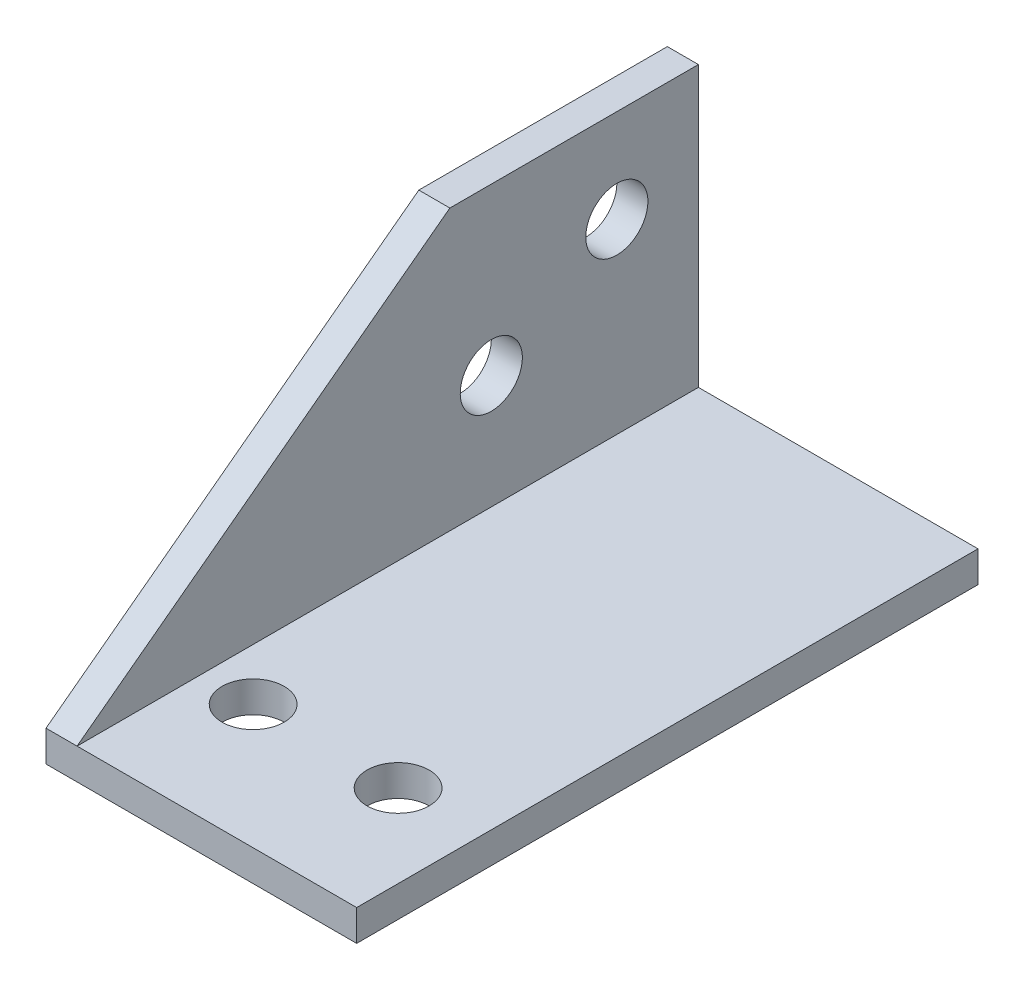
from build123d import *

# Parameters (mm, degrees)
EXTRUSION1_DEPTH = 30
ESQUISSE2_R      = 1.5
EXTRUSION2_DEPTH = 50
ESQUISSE3_R      = 1.5
EXTRUSION3_DEPTH = 50


with BuildPart() as part:
    # Esquisse1 → Extrusion1 (new body)
    with BuildSketch(Plane.XY):
        Polygon((-13.999949538, 0.682421053), (-15.499949538, 0.682421053), (-15.499949538, -14.317578947), (-0.499949538, -14.317578947), (-0.499949538, -12.817578947), (-13.999949538, -12.817578947), align=None)
    extrude(amount=EXTRUSION1_DEPTH)

    # Esquisse2 → Extrusion2 (cut)
    with BuildSketch(Plane(origin=(0, -12.817578947, 0), x_dir=(-1, 0, 0), z_dir=(0, 1, 0))):
        with Locations((4.499949538, 24)):
            Circle(ESQUISSE2_R)
        with Locations((11.499949538, 24)):
            Circle(ESQUISSE2_R)
    extrude(amount=-EXTRUSION2_DEPTH, mode=Mode.SUBTRACT)

    # Esquisse3 → Extrusion3 (cut)
    with BuildSketch(Plane(origin=(-13.999949538, 0, 0), x_dir=(0, 0, -1), z_dir=(1, 0, 0))):
        with Locations(Location((-10, -7.317578947, 0), (0, 0, 90))):
            Circle(ESQUISSE3_R)
        with Locations(Location((-3.937822174, -3.817578947, 0), (0, 0, 90))):
            Circle(ESQUISSE3_R)
        Polygon((-30, 0.682421053), (-30, -12.817578947), (-12, 0.682421053), align=None)
    extrude(amount=-EXTRUSION3_DEPTH, mode=Mode.SUBTRACT)


solid = part.part
